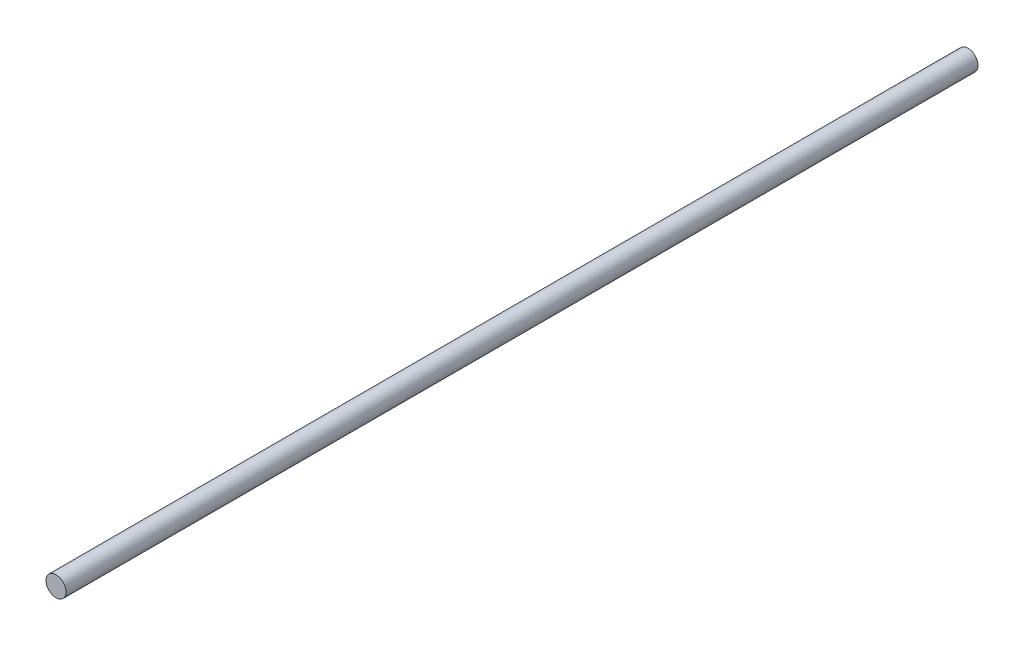
from build123d import *

# Parameters (mm, degrees)
CROQUIS1_R              = 2.75
SALIENTE_EXTRUIR1_DEPTH = 125


with BuildPart() as part:
    # Croquis1 → Saliente-Extruir1 (new, symmetric)
    with BuildSketch(Plane.XY):
        Circle(CROQUIS1_R)
    extrude(amount=SALIENTE_EXTRUIR1_DEPTH, both=True)


solid = part.part
